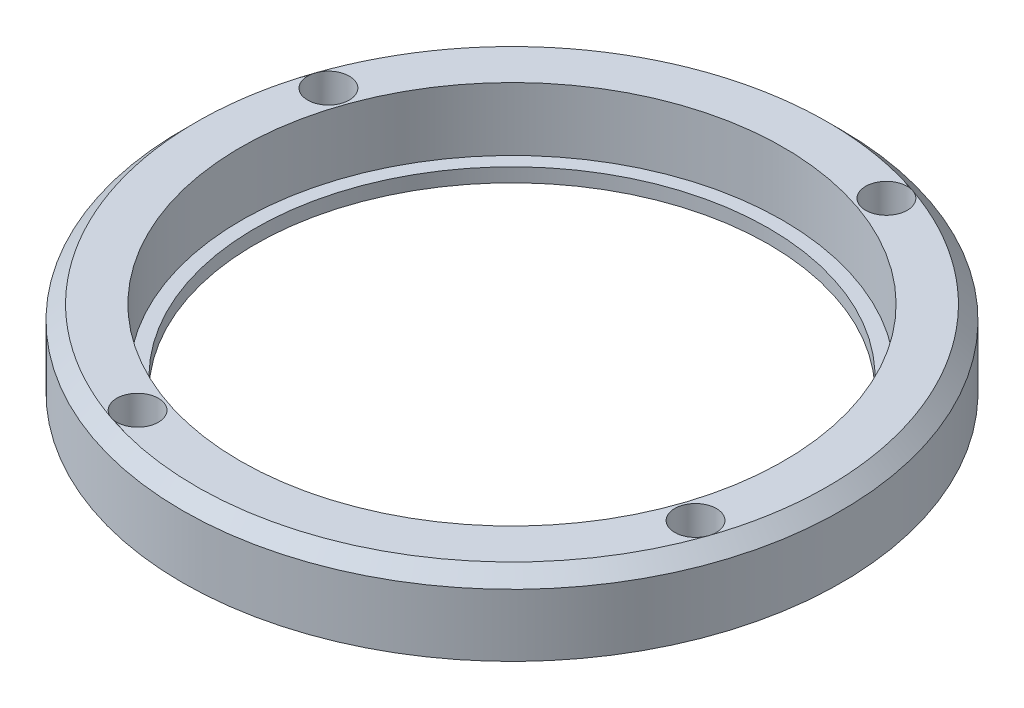
from build123d import *

# Parameters (mm, degrees)
SKETCH1_R           = 47.5
BOSS_EXTRUDE1_DEPTH = 11
SKETCH2_R           = 39.15
CUT_EXTRUDE1_DEPTH  = 69.0698171
CHAMFER1_SIZE       = 2
SKETCH5_R           = 1.75
CUT_EXTRUDE2_DEPTH  = 69.0698171
SKETCH6_R           = 3
CUT_EXTRUDE3_DEPTH  = 6
SKETCH8_R           = 39
SKETCH8_R_2         = 37
BOSS_EXTRUDE2_DEPTH = 2


with BuildPart() as part:
    # Sketch1 → Boss-Extrude1 (new body)
    with BuildSketch(Plane(origin=(0, 0, 0), x_dir=(1, 0, 0), z_dir=(0, 1, 0))):
        with Locations(Location((0, 0, 0), (0, 0, 270))):
            Circle(SKETCH1_R)
    extrude(amount=BOSS_EXTRUDE1_DEPTH)

    # Sketch2 → Cut-Extrude1 (cut, through all)
    with BuildSketch(Plane(origin=(0, 11, 0), x_dir=(1, 0, 0), z_dir=(0, 1, 0))):
        with Locations(Location((0, 0, 0), (0, 0, 270))):
            Circle(SKETCH2_R)
    extrude(amount=-CUT_EXTRUDE1_DEPTH, mode=Mode.SUBTRACT)

    # Chamfer1
    chamfer1_edges = [part.edges().sort_by_distance(p)[0] for p in [
        (0, 11, -47.5),
    ]]
    chamfer(chamfer1_edges, length=CHAMFER1_SIZE)

    # Sketch5 → Cut-Extrude2 (cut, through all)
    with BuildSketch(Plane(origin=(0, 11, 0), x_dir=(1, 0, 0), z_dir=(0, 1, 0))):
        with Locations(Location((13.756419634, 40.212074292, 0), (0, 0, 270))):
            Circle(SKETCH5_R)
        with Locations(Location((40.212074292, -13.756419634, 0), (0, 0, 270))):
            Circle(SKETCH5_R)
        with Locations(Location((-13.756419634, -40.212074292, 0), (0, 0, 270))):
            Circle(SKETCH5_R)
        with Locations(Location((-40.212074292, 13.756419634, 0), (0, 0, 270))):
            Circle(SKETCH5_R)
    extrude(amount=-CUT_EXTRUDE2_DEPTH, mode=Mode.SUBTRACT)

    # Sketch6 → Cut-Extrude3 (cut)
    with BuildSketch(Plane(origin=(0, 11, 0), x_dir=(1, 0, 0), z_dir=(0, 1, 0))):
        with Locations(Location((-13.756419634, -40.212074292, 0), (0, 0, 270))):
            Circle(SKETCH6_R)
        with Locations(Location((13.756419634, 40.212074292, 0), (0, 0, 270))):
            Circle(SKETCH6_R)
        with Locations(Location((40.212074292, -13.756419634, 0), (0, 0, 270))):
            Circle(SKETCH6_R)
        with Locations(Location((-40.212074292, 13.756419634, 0), (0, 0, 270))):
            Circle(SKETCH6_R)
    extrude(amount=-CUT_EXTRUDE3_DEPTH, mode=Mode.SUBTRACT)


with BuildPart() as body_2:
    # Sketch8 → Boss-Extrude2 (new body)
    with BuildSketch(Plane(origin=(0, 0, 0), x_dir=(-1, 0, 0), z_dir=(0, -1, 0))):
        with Locations(Location((0, 0, 0), (0, 0, 90))):
            Circle(SKETCH8_R)
        with Locations(Location((0, 0, 0), (0, 0, 90))):
            Circle(SKETCH8_R_2, mode=Mode.SUBTRACT)
    extrude(amount=-BOSS_EXTRUDE2_DEPTH)


solid = Compound([part.part, body_2.part])
